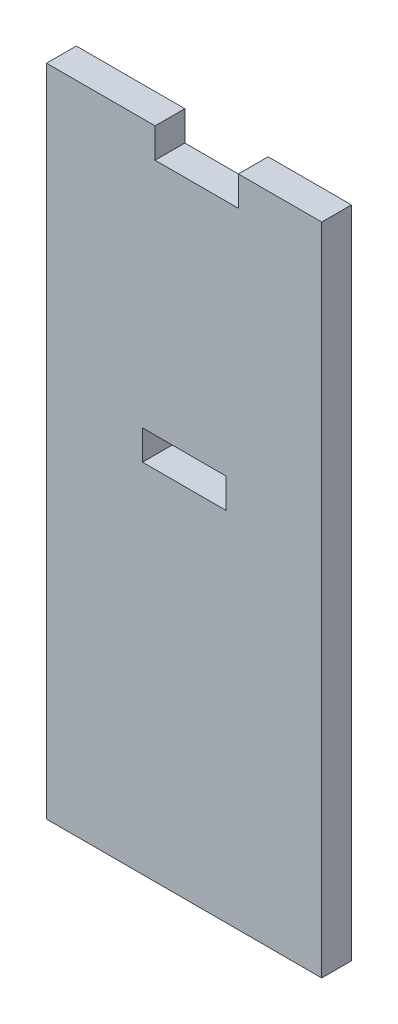
from build123d import *

# Parameters (mm, degrees)
SKETCH1_W           = 7
SKETCH1_H           = 2.5
BOSS_EXTRUDE1_DEPTH = 2.5


with BuildPart() as part:
    # Sketch1 → Boss-Extrude1 (new body)
    with BuildSketch(Plane.XY):
        Polygon((11.56, 30), (4.56, 30), (4.56, 27.5), (-2.44, 27.5), (-2.44, 30), (-11.56, 30), (-11.56, -25), (11.56, -25), align=None)
        with Locations((0, 6.25)):
            Rectangle(SKETCH1_W, SKETCH1_H, mode=Mode.SUBTRACT)
    extrude(amount=BOSS_EXTRUDE1_DEPTH)


solid = part.part
